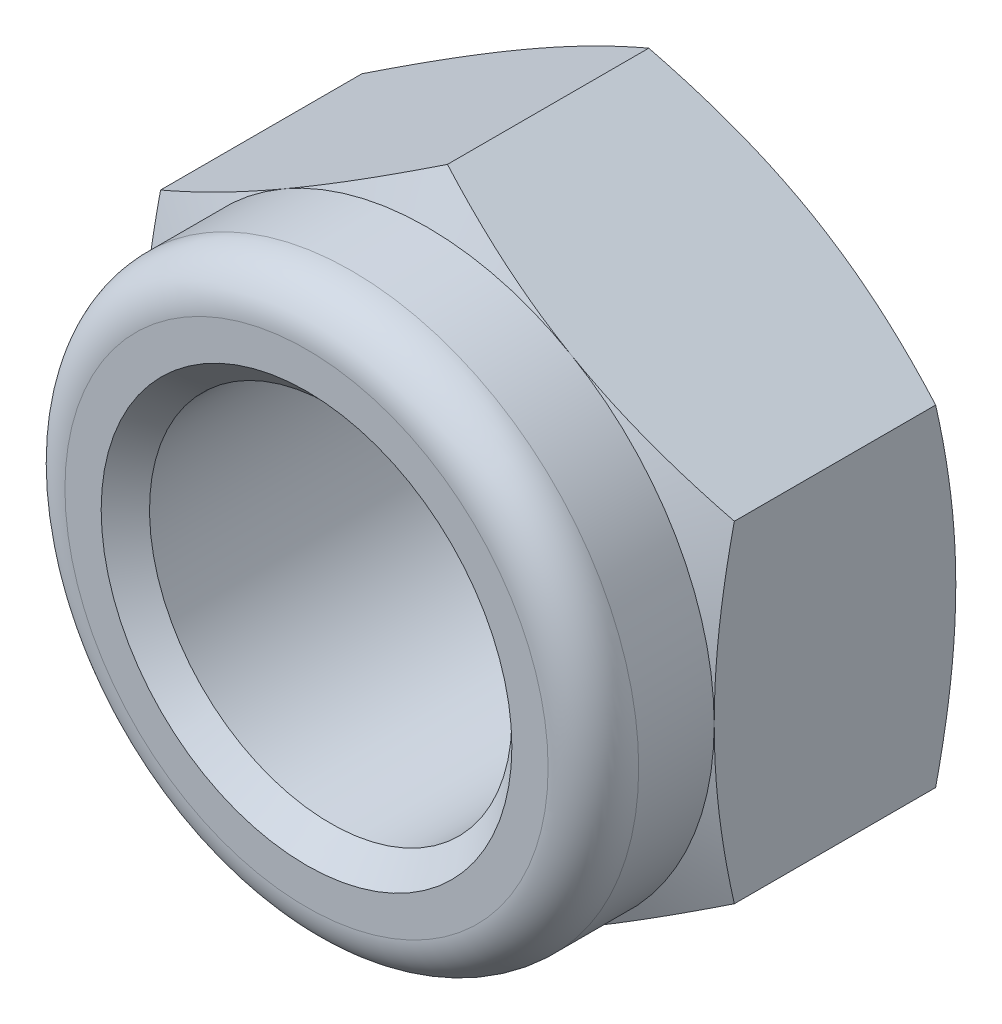
from build123d import *

# Parameters (mm, degrees)
SKETCH1_R           = 6
BOSS_EXTRUDE1_DEPTH = 8


with BuildPart() as part:
    # Sketch1 → Boss-Extrude1 (new body)
    with BuildSketch(Plane.XY):
        Polygon((0, -10.969655115), (9.5, -5.484827557), (9.5, 5.484827557), (0, 10.969655115), (-9.5, 5.484827557), (-9.5, -5.484827557), align=None)
        Circle(SKETCH1_R, mode=Mode.SUBTRACT)
    extrude(amount=BOSS_EXTRUDE1_DEPTH)

    # Sketch3 → Revolve1 (revolve)
    with BuildSketch(Plane(origin=(0, 0, 0), x_dir=(0, 0, -1), z_dir=(0, 1, 0))):
        with BuildLine():
            Line((-8, 9.5), (-10.5, 9.5))
            ThreePointArc((-10.5, 9.5), (-11.560660172, 9.060660172), (-12, 8))
            Line((-12, 8), (-12, 6))
            Line((-12, 6), (-8, 6))
            Line((-8, 6), (-8, 9.5))
        make_face()
    revolve(axis=Axis((0, 0, 0), (0, 0, 1)))

    # Sketch2 → Cut-Revolve1 (revolve, cut)
    with BuildSketch(Plane(origin=(0, 0, 0), x_dir=(0, 0, -1), z_dir=(1, 0, 0))):
        Polygon((-8, 10.969655115), (-8, 9.5), (-7.333333333, 10.969655115), align=None)
        Polygon((-0.666666667, 10.969655115), (0, 10.969655115), (0, 9.5), align=None)
        Polygon((-12, 6), (-11.2, 6), (-12, 6.8), align=None)
        Polygon((0, 6), (-0.8, 6), (0, 6.8), align=None)
    revolve(axis=Axis((0, 0, 0), (0, 0, 1)), mode=Mode.SUBTRACT)


solid = part.part
